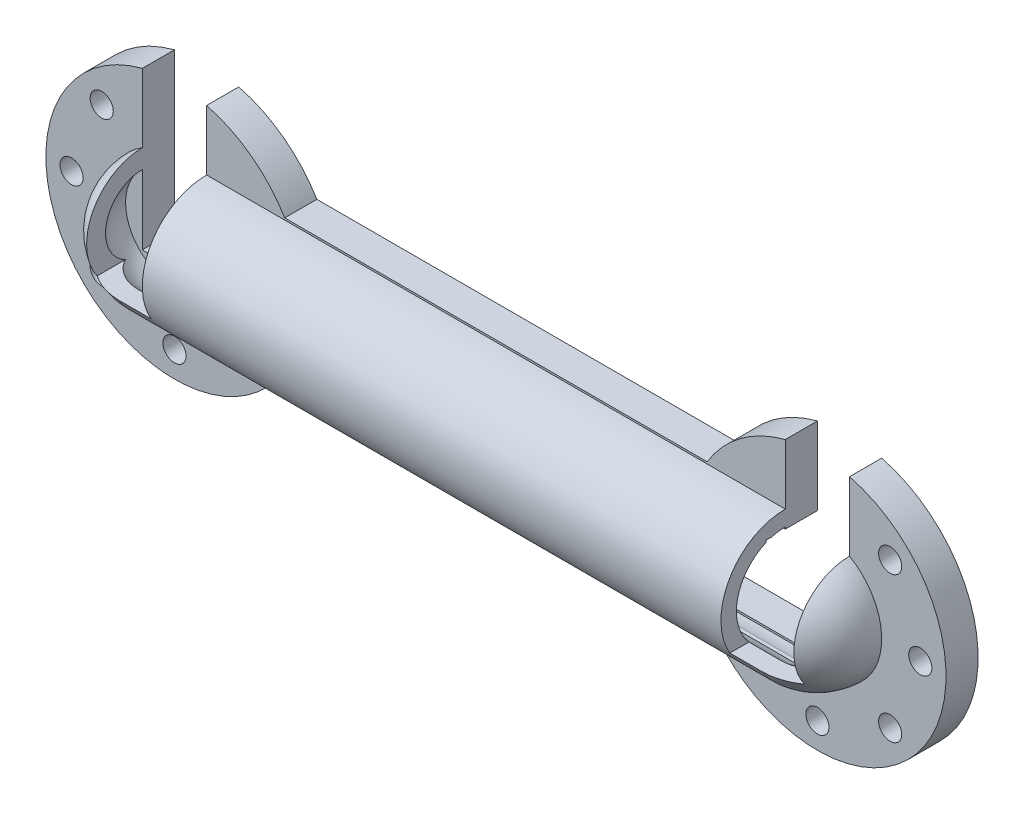
from build123d import *

# Parameters (mm, degrees)
ESQUISSE1_R                  = 2.45
BOSS_EXTRU_1_DEPTH           = 2.5
BOSS_EXTRU_4_START           = -2.5
ESQUISSE4_R                  = 10
ESQUISSE4_R_2                = 2.45
BOSS_EXTRU_4_DEPTH           = 2.5
ESQUISSE5_R                  = 0.9
ENL_V_MAT_EXTRU_3_DEPTH      = 10
R_VOLUTION1_ANGLE            = 90
R_VOLUTION1_OTHER_WAY_ANGLE  = 90
R_VOLUTION2_ANGLE            = 90
R_VOLUTION3_ANGLE            = 90
ESQUISSE9_W                  = 52
ESQUISSE9_H                  = 7.295463698
ENL_V_MAT_EXTRU_4_DEPTH      = 4
ENL_V_MAT_EXTRU_5_DEPTH      = 62.032778079
ENL_V_MAT_EXTRU_5_DEPTH_BACK = 62.032778079
ESQUISSE10_W                 = 5
ESQUISSE10_H                 = 14.990995253


with BuildPart() as part:
    # Esquisse1 → Boss.-Extru.1 (new body)
    with BuildSketch(Plane.XY):
        with BuildLine():
            Line((0, 5.147731849), (50, 5.147731849))
            ThreePointArc((50, 5.147731849), (55.147731849, 0), (50, -5.147731849))
            Line((50, -5.147731849), (0, -5.147731849))
            ThreePointArc((0, -5.147731849), (-5.147731849, 0), (0, 5.147731849))
        make_face()
        Circle(ESQUISSE1_R, mode=Mode.SUBTRACT)
        with Locations((50, 0)):
            Circle(ESQUISSE1_R, mode=Mode.SUBTRACT)
    extrude(amount=BOSS_EXTRU_1_DEPTH)

    # Esquisse4 → Boss.-Extru.4 (add)
    # profile 1 of 2: a face of its own
    with BuildSketch(Plane.XY.offset(2.5).offset(BOSS_EXTRU_4_START)):
        Circle(ESQUISSE4_R)
        Circle(ESQUISSE4_R_2, mode=Mode.SUBTRACT)
    # profile 2 of 2: a face of its own
    with BuildSketch(Plane.XY.offset(2.5).offset(BOSS_EXTRU_4_START)):
        with Locations((50, 0)):
            Circle(ESQUISSE4_R)
        with Locations((50, 0)):
            Circle(ESQUISSE4_R_2, mode=Mode.SUBTRACT)
    extrude(amount=BOSS_EXTRU_4_DEPTH)

    # Esquisse5 → Enlèv. mat.-Extru.3 (cut)
    with BuildSketch(Plane.XY.offset(2.5)):
        with Locations((-8, 0)):
            Circle(ESQUISSE5_R)
        with Locations((-5.656854249, 5.656854249)):
            Circle(ESQUISSE5_R)
        with Locations((0, 8)):
            Circle(ESQUISSE5_R)
        with Locations((0, -8)):
            Circle(ESQUISSE5_R)
        with Locations((-5.656854249, -5.656854249)):
            Circle(ESQUISSE5_R)
        with Locations((50, -8)):
            Circle(ESQUISSE5_R)
        with Locations((55.656854249, -5.656854249)):
            Circle(ESQUISSE5_R)
        with Locations((58, 0)):
            Circle(ESQUISSE5_R)
        with Locations((55.656854249, 5.656854249)):
            Circle(ESQUISSE5_R)
        with Locations((50, 8)):
            Circle(ESQUISSE5_R)
    extrude(amount=-ENL_V_MAT_EXTRU_3_DEPTH, mode=Mode.SUBTRACT)

    # Esquisse6 → Révolution1 (revolve)
    with BuildSketch(Plane(origin=(0, 0, 0), x_dir=(1, 0, 0), z_dir=(0, 1, 0))):
        Polygon((8.57326407, -6.3), (41.42673593, -6.3), (50, -6.3), (50, -7.5), (41.42673593, -7.5), (8.57326407, -7.5), (0, -7.5), (0, -6.3), align=None)
    revolve(axis=Axis((8.57326407, 0, 2.5), (1, 0, 0)), revolution_arc=R_VOLUTION1_ANGLE)

    # Esquisse6 → Révolution1 other way (revolve)
    with BuildSketch(Plane(origin=(0, 0, 0), x_dir=(1, 0, 0), z_dir=(0, 1, 0))):
        Polygon((8.57326407, -6.3), (41.42673593, -6.3), (50, -6.3), (50, -7.5), (41.42673593, -7.5), (8.57326407, -7.5), (0, -7.5), (0, -6.3), align=None)
    revolve(axis=Axis((8.57326407, 0, 2.5), (-1, 0, 0)), revolution_arc=R_VOLUTION1_OTHER_WAY_ANGLE)

    # Esquisse7 → Révolution2 (revolve)
    with BuildSketch(Plane.ZY):
        with BuildLine():
            Line((2.5, 5), (2.5, 3.8))
            ThreePointArc((2.5, 3.8), (6.3, 0), (2.5, -3.8))
            Line((2.5, -3.8), (2.5, -5))
            ThreePointArc((2.5, -5), (7.5, 0), (2.5, 5))
        make_face()
    revolve(axis=Axis((0, 5, 2.5), (0, -1, 0)), revolution_arc=R_VOLUTION2_ANGLE)

    # Esquisse8 → Révolution3 (revolve)
    with BuildSketch(Plane(origin=(50, 0, 0), x_dir=(0, 0, -1), z_dir=(1, 0, 0))):
        with BuildLine():
            Line((-2.5, 5), (-2.5, 3.8))
            ThreePointArc((-2.5, 3.8), (-6.3, 0), (-2.5, -3.8))
            Line((-2.5, -3.8), (-2.5, -5))
            ThreePointArc((-2.5, -5), (-7.5, 0), (-2.5, 5))
        make_face()
    revolve(axis=Axis((50, 5, 2.5), (0, 1, 0)), revolution_arc=R_VOLUTION3_ANGLE)

    # Esquisse9 → Enlèv. mat.-Extru.4 (cut)
    with BuildSketch(Plane(origin=(0, 0, 0), x_dir=(-1, 0, 0), z_dir=(0, 0, -1))):
        with Locations((-25, 0)):
            Rectangle(ESQUISSE9_W, ESQUISSE9_H)
    extrude(amount=-ENL_V_MAT_EXTRU_4_DEPTH, mode=Mode.SUBTRACT)

    # Esquisse10 → Enlèv. mat.-Extru.5 (cut, two sides: drawn at the far end of the back side and taken through both)
    with BuildSketch(Plane.XY.offset(2.5).offset(-ENL_V_MAT_EXTRU_5_DEPTH_BACK)):
        with Locations((0, 4.954797126)):
            Rectangle(ESQUISSE10_W, ESQUISSE10_H)
        with Locations((50, 4.954797126)):
            Rectangle(ESQUISSE10_W, ESQUISSE10_H)
    extrude(amount=ENL_V_MAT_EXTRU_5_DEPTH + ENL_V_MAT_EXTRU_5_DEPTH_BACK, mode=Mode.SUBTRACT)


solid = part.part
